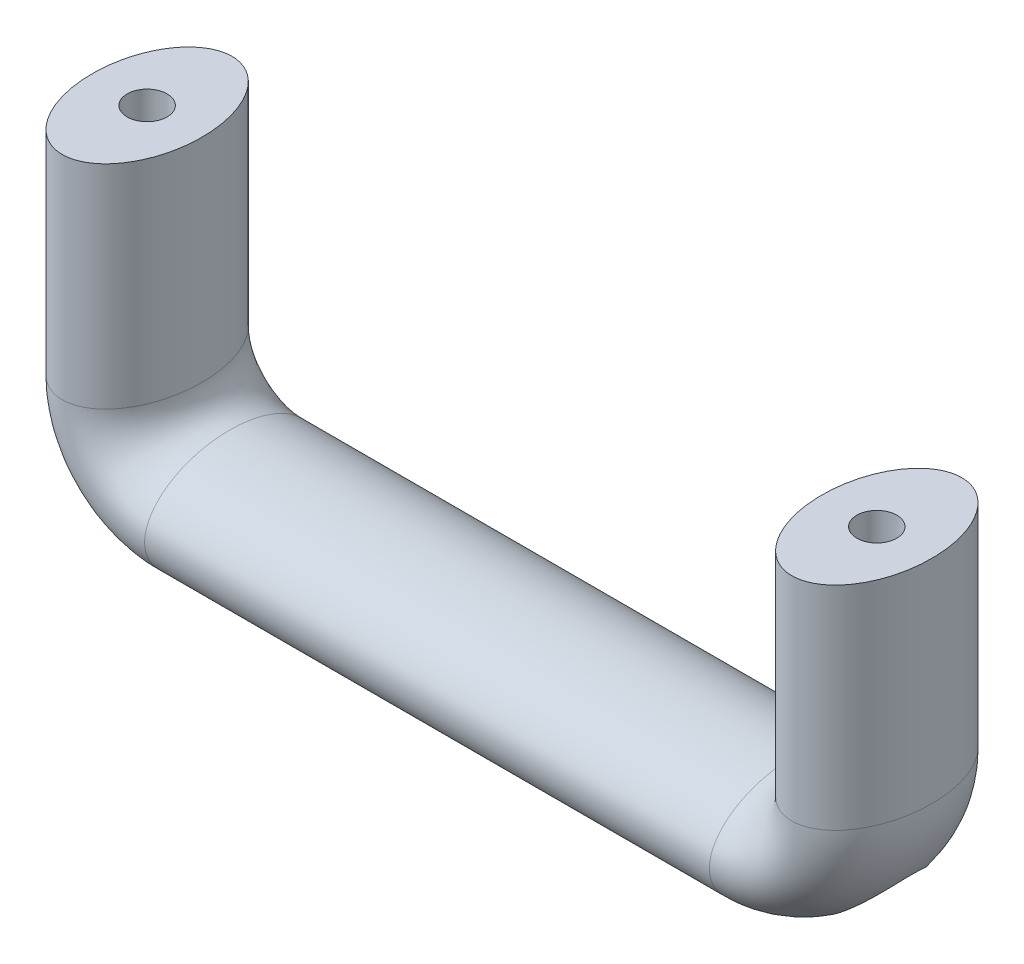
from build123d import *

# Parameters (mm, degrees)
SKETCH2_RX               = 13.49375
SKETCH2_RY               = 8.73125
SKETCH4_R                = 3.175
EXTRUDE1_DEPTH           = 17.4625
SKETCH9_R                = 5.08
EXTRUDE2_DEPTH           = 5.5499
EXTRUDE2_OTHER_WAY_DEPTH = 78.969525699
EXTRUDE2_OTHER_WAY_DRAFT = 1
MIRROR1_COPY_1_SKETCH_R  = 5.08
MIRROR1_COPY_1_DEPTH     = 78.969525699
MIRROR1_COPY_1_DRAFT     = 1
MIRROR1_COPY_2_SKETCH_R  = 5.08
MIRROR1_COPY_2_DEPTH     = 78.969525699
MIRROR1_COPY_2_DRAFT     = 1


with BuildPart() as part:
    # Sweep1: sweep along a path in Sketch3
    with BuildLine(Plane.XY) as sweep1_path:
        Line((57.94375, 46.83125), (57.94375, 13.096875))
        ThreePointArc((57.94375, 13.096875), (54.107764125, 3.835985875), (44.846875, 0))
        Line((44.846875, 0), (-44.846875, 0))
        ThreePointArc((-44.846875, 0), (-54.107764125, 3.835985875), (-57.94375, 13.096875))
        Line((-57.94375, 13.096875), (-57.94375, 46.83125))
    # Sketch2 → Sweep1 (sweep)
    with BuildSketch(Plane(origin=(0, 46.83125, 0), x_dir=(-1, 0, 0), z_dir=(0, 1, 0))):
        with Locations(Location((57.94375, 0), (0, 0, -90))):
            Ellipse(SKETCH2_RX, SKETCH2_RY)
    sweep(path=sweep1_path.line)

    # Sketch4 → Extrude1 (cut)
    with BuildSketch(Plane(origin=(0, 46.83125, 0), x_dir=(-1, 0, 0), z_dir=(0, 1, 0))):
        with Locations(Location((57.94375, 0, 0), (0, 0, 90))):
            Circle(SKETCH4_R)
    extrude1 = extrude(amount=-EXTRUDE1_DEPTH, mode=Mode.SUBTRACT)

    # Sketch9 → Extrude2 (cut)
    with BuildSketch(Plane(origin=(0, 29.36875, 0), x_dir=(1, 0, 0), z_dir=(0, 1, 0))):
        with Locations(Location((-57.94375, 0, 0), (0, 0, 270))):
            Circle(SKETCH9_R)
    extrude2 = extrude(amount=EXTRUDE2_DEPTH, mode=Mode.SUBTRACT)


with BuildPart() as extrude2_other_way_tool:
    # Sketch9 → Extrude2 other way (with draft: the straight prism first)
    with BuildSketch(Plane(origin=(0, 29.36875, 0), x_dir=(1, 0, 0), z_dir=(0, 1, 0))):
        with Locations(Location((-57.94375, 0, 0), (0, 0, 270))):
            Circle(SKETCH9_R)
    extrude(amount=-EXTRUDE2_OTHER_WAY_DEPTH)
    # Extrude2 other way: the draft: its side faces are tilted about the plane it starts from
    extrude2_other_way_sides = [extrude2_other_way_tool.faces().sort_by_distance(p)[0] for p in [
        (-57.94375, -10.116012849, -5.08),
    ]]
    draft(extrude2_other_way_sides, Plane(origin=(0, 29.36875, 0), x_dir=(1, 0, 0), z_dir=(0, 1, 0)), EXTRUDE2_OTHER_WAY_DRAFT)


with BuildPart() as part_1:
    add(part.part)

    # Extrude2 other way: cut by extrude2_other_way_tool
    add(extrude2_other_way_tool.part, mode=Mode.SUBTRACT)

    # Mirror1: Extrude1, Extrude2 across plane
    add(extrude1.mirror(Plane(origin=(0, 0, 0), x_dir=(0, 0, 1), z_dir=(1, 0, 0))), mode=Mode.SUBTRACT)
    add(extrude2.mirror(Plane(origin=(0, 0, 0), x_dir=(0, 0, 1), z_dir=(1, 0, 0))), mode=Mode.SUBTRACT)


with BuildPart() as mirror1_copy_1_tool:
    # Mirror1 copy 1 sketch → Mirror1 copy 1 (with draft: the straight prism first)
    with BuildSketch(Plane(origin=(0, 29.36875, 0), x_dir=(-1, 0, 0), z_dir=(0, 1, 0))):
        with Locations((-57.94375, 0)):
            Circle(MIRROR1_COPY_1_SKETCH_R)
    extrude(amount=-MIRROR1_COPY_1_DEPTH)
    # Mirror1 copy 1: the draft: its side faces are tilted about the plane it starts from
    mirror1_copy_1_sides = [mirror1_copy_1_tool.faces().sort_by_distance(p)[0] for p in [
        (57.94375, -10.116012849, -5.08),
    ]]
    draft(mirror1_copy_1_sides, Plane(origin=(0, 29.36875, 0), x_dir=(-1, 0, 0), z_dir=(0, 1, 0)), MIRROR1_COPY_1_DRAFT)


with BuildPart() as part_2:
    add(part_1.part)

    # Mirror1 copy 1: cut by mirror1_copy_1_tool
    add(mirror1_copy_1_tool.part, mode=Mode.SUBTRACT)


with BuildPart() as mirror1_copy_2_tool:
    # Mirror1 copy 2 sketch → Mirror1 copy 2 (with draft: the straight prism first)
    with BuildSketch(Plane(origin=(0, 29.36875, 0), x_dir=(-1, 0, 0), z_dir=(0, 1, 0))):
        with Locations((-57.94375, 0)):
            Circle(MIRROR1_COPY_2_SKETCH_R)
    extrude(amount=-MIRROR1_COPY_2_DEPTH)
    # Mirror1 copy 2: the draft: its side faces are tilted about the plane it starts from
    mirror1_copy_2_sides = [mirror1_copy_2_tool.faces().sort_by_distance(p)[0] for p in [
        (57.94375, -10.116012849, -5.08),
    ]]
    draft(mirror1_copy_2_sides, Plane(origin=(0, 29.36875, 0), x_dir=(-1, 0, 0), z_dir=(0, 1, 0)), MIRROR1_COPY_2_DRAFT)


with BuildPart() as part_3:
    add(part_2.part)

    # Mirror1 copy 2: cut by mirror1_copy_2_tool
    add(mirror1_copy_2_tool.part, mode=Mode.SUBTRACT)


solid = part_3.part
